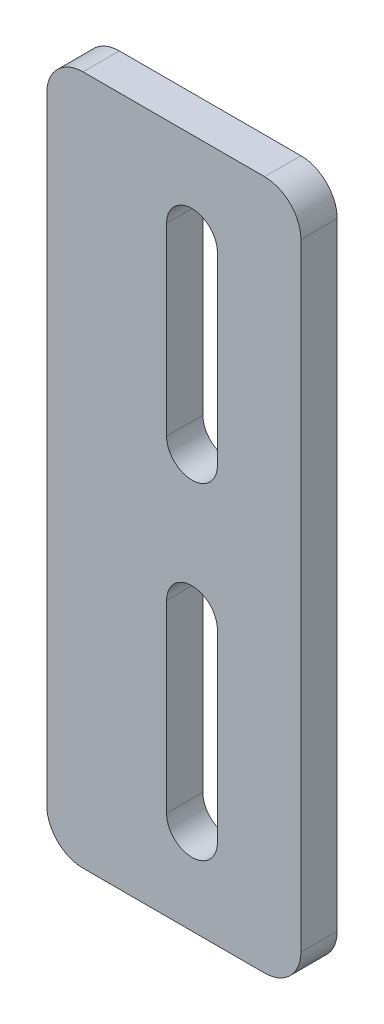
from build123d import *

# Parameters (mm, degrees)
SKETCH1_W           = 35
SKETCH1_H           = 95
BOSS_EXTRUDE1_DEPTH = 5
FILLET1_R           = 5


with BuildPart() as part:
    # Sketch1 → Boss-Extrude1 (new body)
    with BuildSketch(Plane.XY):
        with Locations((17.5, -16.973)):
            Rectangle(SKETCH1_W, SKETCH1_H)
        with BuildLine():
            ThreePointArc((16.5, -7.173), (20, -10.673), (23.5, -7.173))
            Line((23.5, -7.173), (23.5, 18.227))
            ThreePointArc((23.5, 18.227), (20, 21.727), (16.5, 18.227))
            Line((16.5, 18.227), (16.5, -7.173))
        make_face(mode=Mode.SUBTRACT)
        with BuildLine():
            ThreePointArc((23.5, -26.773), (20, -23.273), (16.5, -26.773))
            Line((16.5, -26.773), (16.5, -52.173))
            ThreePointArc((16.5, -52.173), (20, -55.673), (23.5, -52.173))
            Line((23.5, -52.173), (23.5, -26.773))
        make_face(mode=Mode.SUBTRACT)
    extrude(amount=BOSS_EXTRUDE1_DEPTH)

    # Fillet1
    fillet1_edges = [part.edges().sort_by_distance(p)[0] for p in [
        (0, -64.473, 2.5),
        (0, 30.527, 2.5),
        (35, 30.527, 2.5),
        (35, -64.473, 2.5),
    ]]
    fillet(fillet1_edges, radius=FILLET1_R)


solid = part.part
